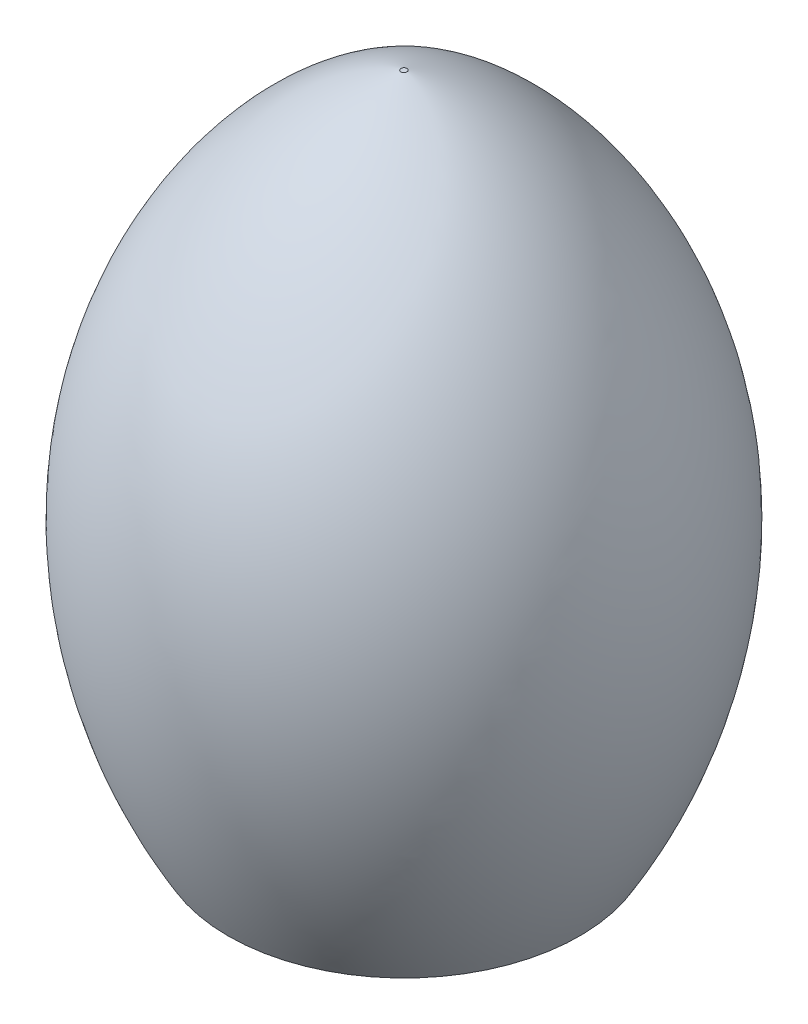
from build123d import *


with BuildPart() as part:
    # Sketch3 → Revolve2 (revolve)
    with BuildSketch(Plane(origin=(0, -67.031201242, 0), x_dir=(0, 0, -1), z_dir=(1, 0, 0))):
        with BuildLine():
            add(Edge.make_bspline(
                [(-1.733589523, -89.409016069), (-1.99736032, -88.951339009), (-2.521661549, -88.043804263), (-3.596186919, -86.166179777), (-5.408532911, -82.86731887), (-8.831443894, -76.152994285), (-13.091508451, -66.289684347), (-17.156029835, -54.093129241), (-21.104496752, -37.467318384), (-23.152235184, -16.215102001), (-20.985796534, 5.089174087), (-16.513939147, 21.795152409), (-10.129409488, 38.180304288), (-0.917912269, 53.66729944), (10.807602914, 66.97885035), (20.795056297, 75.55535071), (30.060858253, 81.25039371), (37.988800039, 84.755808518), (42.134962805, 86.133235661), (44.231994393, 86.715275771)],
                knots=[-0.008619991, -0.008619991, -0.008619991, -0.008619991, -0.000740147, 0.007139697, 0.022899384, 0.054418759, 0.117457508, 0.180496257, 0.243535007, 0.369612506, 0.495690005, 0.558728754, 0.621767503, 0.747845002, 0.810883752, 0.873922501, 0.936961251, 0.968480625, 1, 1, 1, 1], degree=3))
            Line((44.231994393, 86.715275771), (45.034326199, 86.715275771))
            Line((45.034326199, 86.715275771), (45.034326199, 83.824555502))
            add(Edge.make_bspline(
                [(0, -86.409016069), (-19.811004259, -52.034315357), (-30.028997158, 18.566820254), (19.010829705, 76.601622459), (45.034326199, 83.824555502)],
                knots=[0, 0, 0, 0, 0.591830554, 1, 1, 1, 1], degree=3))
            Line((0, -86.409016069), (45.034326199, -86.409016069))
            Line((45.034326199, -86.409016069), (45.034326199, -89.409016069))
            Line((45.034326199, -89.409016069), (-1.733589523, -89.409016069))
        make_face()
    revolve(axis=Axis((0, 16.79335426, -45.034326199), (0, -1, 0)))


solid = part.part
